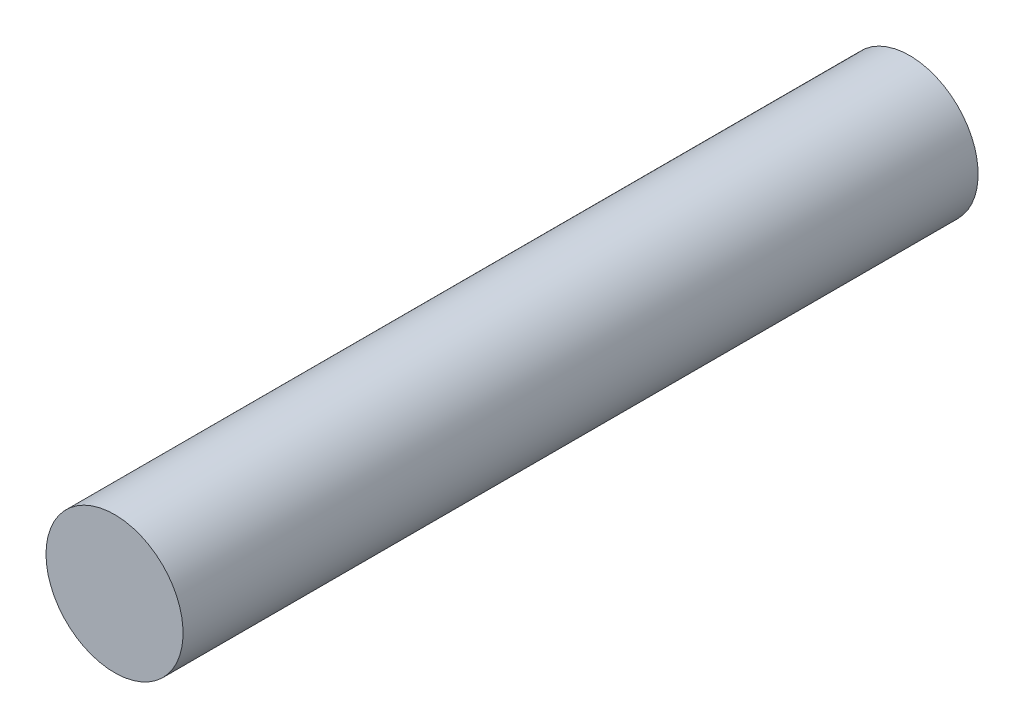
from build123d import *

# Parameters (mm, degrees)
SKETCH_1_R      = 2.5
EXTRUDE_1_DEPTH = 29


with BuildPart() as part:
    # 草图1 → 凸台-拉伸1 (new body)
    with BuildSketch(Plane.XY):
        with Locations(Location((0, 0, 0), (0, 0, 180))):
            Circle(SKETCH_1_R)
    extrude(amount=EXTRUDE_1_DEPTH)


solid = part.part
